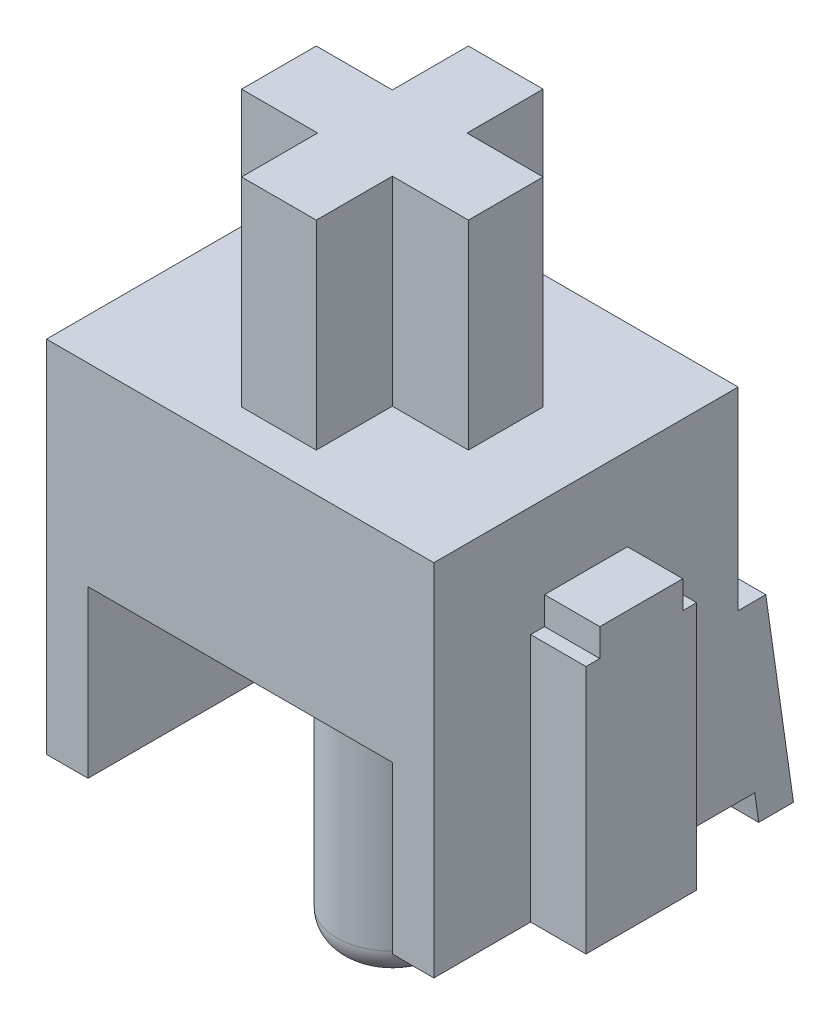
from build123d import *

# Parameters (mm, degrees)
SKETCH1_W               = 7
SKETCH1_H               = 5.5
BOSS_EXTRUDE1_DEPTH     = 6.5
SKETCH4_W               = 5.5
SKETCH4_H               = 3
CUT_EXTRUDE1_DEPTH      = 10.20597632
BOSS_EXTRUDE2_DEPTH     = 1
BOSS_EXTRUDE3_DEPTH     = 1
SKETCH8_R               = 2.25
CUT_EXTRUDE2_DEPTH      = 2
BOSS_EXTRUDE4_DEPTH     = 3.6
SKETCH11_R              = 1
BOSS_EXTRUDE5_DEPTH     = 7.5
FILLET1_R               = 0.5
SKETCH12_W              = 0.75
SKETCH12_H              = 3
BOSS_EXTRUDE6_DEPTH     = 1
SKETCH14_W              = 0.75
SKETCH14_H              = 1
BOSS_EXTRUDE7_DEPTH     = 0.5
CUT_EXTRUDE3_DEPTH      = 14.419109508
CUT_EXTRUDE3_DEPTH_BACK = 14.419109508


with BuildPart() as part:
    # Sketch1 → Boss-Extrude1 (new body)
    with BuildSketch(Plane(origin=(0, 0, 0), x_dir=(1, 0, 0), z_dir=(0, 1, 0))):
        Rectangle(SKETCH1_W, SKETCH1_H)
    extrude(amount=BOSS_EXTRUDE1_DEPTH)

    # Sketch4 → Cut-Extrude1 (cut, through all)
    with BuildSketch(Plane.XY.offset(2.75)):
        with Locations((0, 1.5)):
            Rectangle(SKETCH4_W, SKETCH4_H)
    extrude(amount=-CUT_EXTRUDE1_DEPTH, mode=Mode.SUBTRACT)

    # Sketch6 → Boss-Extrude2 (add)
    with BuildSketch(Plane.ZY.offset(3.5)):
        Polygon((-1, 4.5), (-0.75, 4.5), (-0.75, 5), (0.75, 5), (0.75, 4.5), (1, 4.5), (1, 0), (-1, 0), align=None)
    extrude(amount=BOSS_EXTRUDE2_DEPTH)

    # Sketch7 → Boss-Extrude3 (add)
    with BuildSketch(Plane(origin=(3.5, 0, 0), x_dir=(0, 0, -1), z_dir=(1, 0, 0))):
        Polygon((-1, 0), (-1, 4.5), (-0.75, 4.5), (-0.75, 5), (0.75, 5), (0.75, 4.5), (1, 4.5), (1, 0), align=None)
    extrude(amount=BOSS_EXTRUDE3_DEPTH)

    # Sketch8 → Cut-Extrude2 (cut)
    with BuildSketch(Plane.XZ.offset(-3)):
        with Locations(Location((0, 0, 0), (0, 0, 270))):
            Circle(SKETCH8_R)
    extrude(amount=-CUT_EXTRUDE2_DEPTH, mode=Mode.SUBTRACT)

    # Sketch10 → Boss-Extrude4 (add)
    with BuildSketch(Plane(origin=(0, 6.5, 0), x_dir=(1, 0, 0), z_dir=(0, 1, 0))):
        Polygon((-2.05, -0.675), (-2.05, 0.675), (-0.675, 0.675), (-0.675, 2.05), (0.675, 2.05), (0.675, 0.675), (2.05, 0.675), (2.05, -0.675), (0.675, -0.675), (0.675, -2.05), (-0.675, -2.05), (-0.675, -0.675), align=None)
    extrude(amount=BOSS_EXTRUDE4_DEPTH)

    # Sketch11 → Boss-Extrude5 (add)
    with BuildSketch(Plane.XZ.offset(-5)):
        with Locations(Location((0, 0, 0), (0, 0, 270))):
            Circle(SKETCH11_R)
    extrude(amount=BOSS_EXTRUDE5_DEPTH)

    # Fillet1
    fillet1_edges = [part.edges().sort_by_distance(p)[0] for p in [
        (0, -2.5, 1),
    ]]
    fillet(fillet1_edges, radius=FILLET1_R)

    # Sketch12 → Boss-Extrude6 (add)
    with BuildSketch(Plane(origin=(0, 0, -2.75), x_dir=(-1, 0, 0), z_dir=(0, 0, -1))):
        with Locations((-3.125, 1.5)):
            Rectangle(SKETCH12_W, SKETCH12_H)
        with Locations((3.125, 1.5)):
            Rectangle(SKETCH12_W, SKETCH12_H)
    extrude(amount=BOSS_EXTRUDE6_DEPTH)

    # Sketch14 → Boss-Extrude7 (add)
    with BuildSketch(Plane.XZ):
        with Locations((-3.125, -3.25)):
            Rectangle(SKETCH14_W, SKETCH14_H)
        with Locations((3.125, -3.25)):
            Rectangle(SKETCH14_W, SKETCH14_H)
    extrude(amount=BOSS_EXTRUDE7_DEPTH)

    # Sketch15 → Cut-Extrude3 (cut, two sides: drawn at the far end of the back side and taken through both)
    with BuildSketch(Plane(origin=(3.5, 0, 0), x_dir=(0, 0, -1), z_dir=(1, 0, 0)).offset(-CUT_EXTRUDE3_DEPTH_BACK)):
        Polygon((3.75, 3), (3.25, 3), (3.75, -0.5), align=None)
        Polygon((2.75, 0), (3.05, 0), (3.121428571, -0.5), (2.75, -0.5), align=None)
    extrude(amount=CUT_EXTRUDE3_DEPTH + CUT_EXTRUDE3_DEPTH_BACK, mode=Mode.SUBTRACT)


solid = part.part
